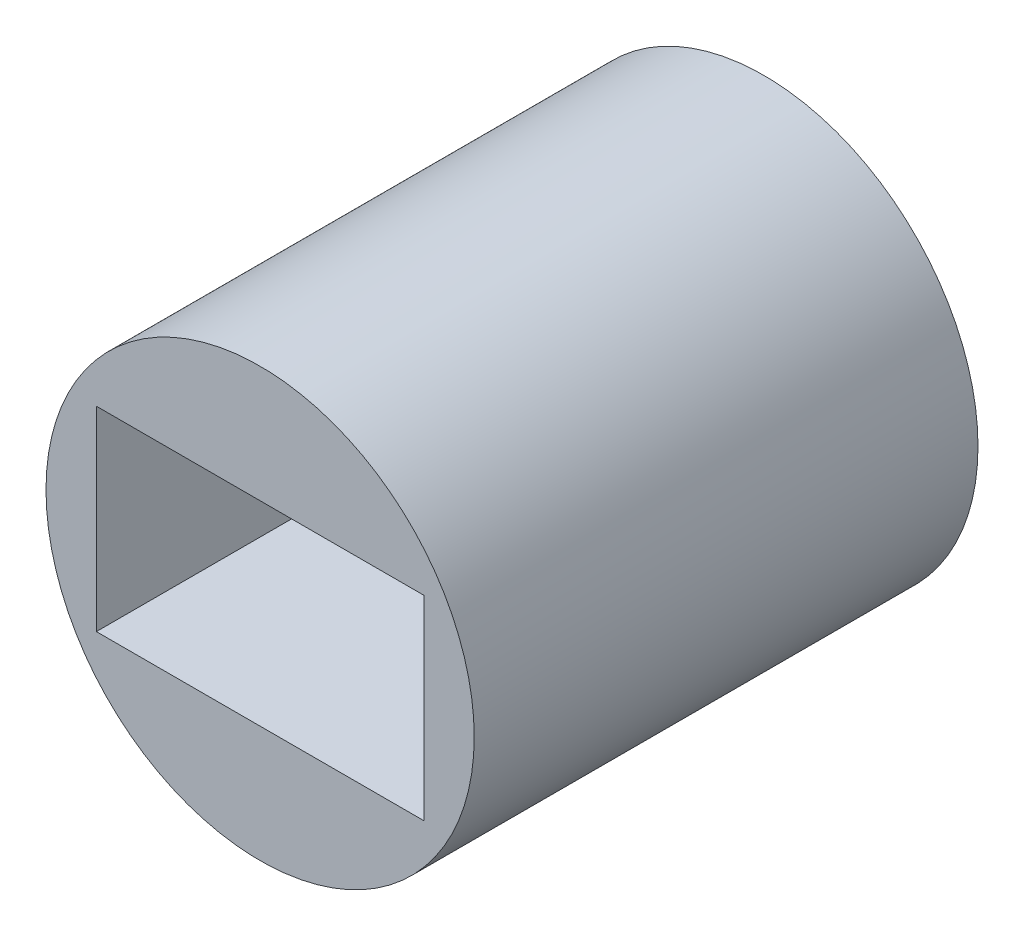
from build123d import *

# Parameters (mm, degrees)
CROQUIS1_R              = 3.4
CROQUIS1_W              = 5.2
CROQUIS1_H              = 3.1
SALIENTE_EXTRUIR1_DEPTH = 8


with BuildPart() as part:
    # Croquis1 → Saliente-Extruir1 (new body)
    with BuildSketch(Plane.XY):
        Circle(CROQUIS1_R)
        Rectangle(CROQUIS1_W, CROQUIS1_H, mode=Mode.SUBTRACT)
    extrude(amount=SALIENTE_EXTRUIR1_DEPTH)


solid = part.part
